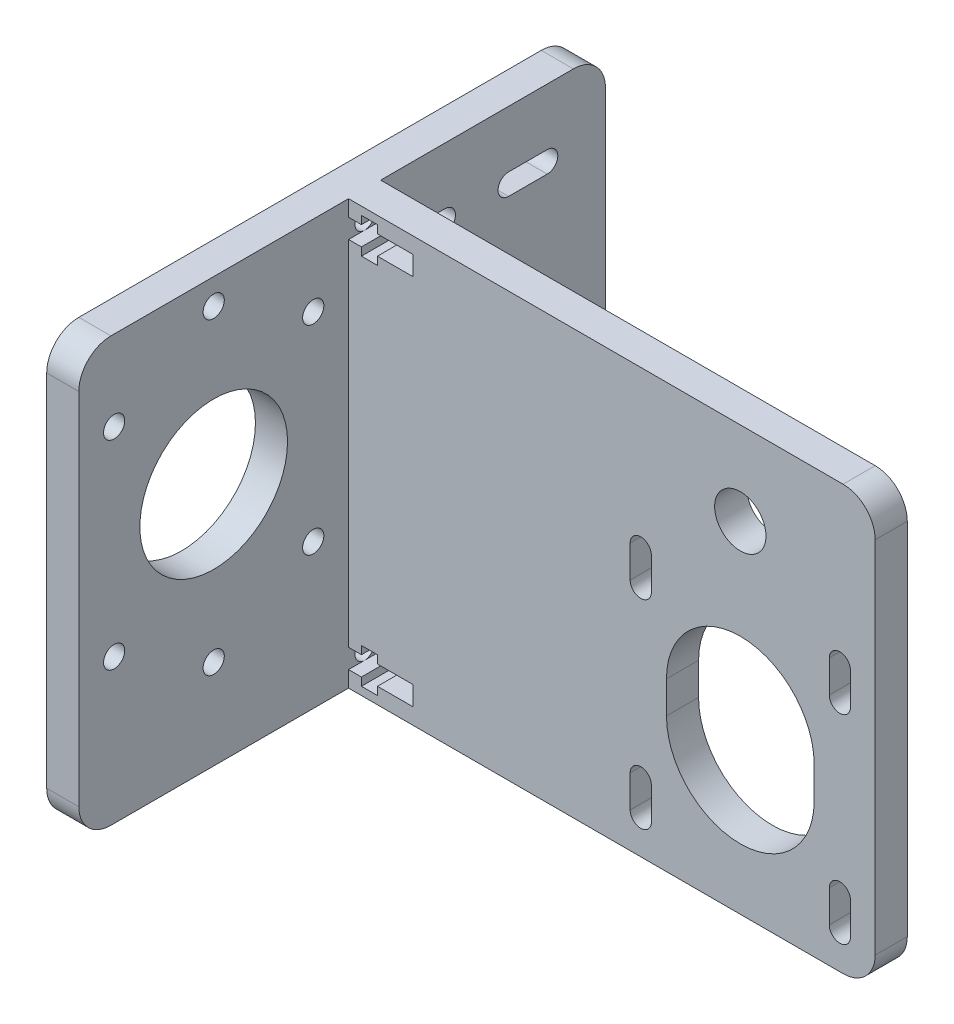
from build123d import *

# Parameters (mm, degrees)
BOSS_EXTRUDE1_DEPTH = 60
SKETCH2_R           = 1.65
SKETCH2_R_2         = 11.5
CUT_EXTRUDE1_DEPTH  = 60
SKETCH3_R           = 1.65
SKETCH3_R_2         = 11.5
CUT_EXTRUDE2_DEPTH  = 60
CUT_EXTRUDE3_START  = -21
SKETCH4_R           = 4
CUT_EXTRUDE3_DEPTH  = 21
SKETCH5_R           = 2.5
CUT_EXTRUDE4_DEPTH  = 6
CUT_EXTRUDE5_DEPTH  = 10
SKETCH9_R           = 5.25
CUT_EXTRUDE7_DEPTH  = 3
CHAMFER1_SIZE       = 1
SKETCH10_W          = 5
SKETCH10_H          = 82
BOSS_EXTRUDE2_DEPTH = 6
FILLET1_R           = 5
SKETCH11_R          = 1.65
CUT_EXTRUDE8_DEPTH  = 10
CUT_EXTRUDE9_DEPTH  = 5
SKETCH13_W          = 82
SKETCH13_H          = 5
BOSS_EXTRUDE3_DEPTH = 6
FILLET2_R           = 5
SKETCH14_R          = 1.5
CUT_EXTRUDE10_DEPTH = 5
CUT_EXTRUDE11_DEPTH = 5


with BuildPart() as part:
    # Sketch1 → Boss-Extrude1 (new body)
    with BuildSketch(Plane(origin=(0, 0, 0), x_dir=(1, 0, 0), z_dir=(0, 1, 0))):
        Polygon((0, 0), (0, -42), (-5, -42), (-5, 40), (0, 40), (0, 5), (82, 5), (82, 0), align=None)
    extrude(amount=BOSS_EXTRUDE1_DEPTH)

    # Sketch2 → Cut-Extrude1 (cut)
    with BuildSketch(Plane.XY):
        with Locations((45.5, 36.5)):
            Circle(SKETCH2_R)
        with Locations((76.5, 36.5)):
            Circle(SKETCH2_R)
        with Locations((76.5, 5.5)):
            Circle(SKETCH2_R)
        with Locations((45.5, 5.5)):
            Circle(SKETCH2_R)
        with Locations((61, 21)):
            Circle(SKETCH2_R_2)
    extrude(amount=-CUT_EXTRUDE1_DEPTH, mode=Mode.SUBTRACT)

    # Sketch3 → Cut-Extrude2 (cut)
    with BuildSketch(Plane(origin=(0, 0, 0), x_dir=(0, 0, -1), z_dir=(1, 0, 0))):
        with Locations((-36.5, 53.5)):
            Circle(SKETCH3_R)
        with Locations((-5.5, 53.5)):
            Circle(SKETCH3_R)
        with Locations((-5.5, 22.5)):
            Circle(SKETCH3_R)
        with Locations((-36.5, 22.5)):
            Circle(SKETCH3_R)
        with Locations((-21, 38)):
            Circle(SKETCH3_R_2)
    extrude(amount=-CUT_EXTRUDE2_DEPTH, mode=Mode.SUBTRACT)

    # Sketch4 → Cut-Extrude3 (cut)
    with BuildSketch(Plane(origin=(0, 0, -5), x_dir=(-1, 0, 0), z_dir=(0, 0, -1)).offset(CUT_EXTRUDE3_START)):
        with Locations((-61, 53)):
            Circle(SKETCH4_R)
        with BuildLine():
            Line((-47.15, 36.5), (-47.15, 41.5))
            ThreePointArc((-47.15, 41.5), (-45.5, 43.15), (-43.85, 41.5))
            Line((-43.85, 41.5), (-43.85, 36.5))
            ThreePointArc((-43.85, 36.5), (-45.5, 34.85), (-47.15, 36.5))
        make_face()
        with BuildLine():
            Line((-78.15, 36.5), (-78.15, 41.5))
            ThreePointArc((-78.15, 41.5), (-76.5, 43.15), (-74.85, 41.5))
            Line((-74.85, 41.5), (-74.85, 36.5))
            ThreePointArc((-74.85, 36.5), (-76.5, 34.85), (-78.15, 36.5))
        make_face()
        with BuildLine():
            Line((-78.15, 5.5), (-78.15, 10.5))
            ThreePointArc((-78.15, 10.5), (-76.5, 12.15), (-74.85, 10.5))
            Line((-74.85, 10.5), (-74.85, 5.5))
            ThreePointArc((-74.85, 5.5), (-76.5, 3.85), (-78.15, 5.5))
        make_face()
        with BuildLine():
            Line((-47.15, 5.5), (-47.15, 10.5))
            ThreePointArc((-47.15, 10.5), (-45.5, 12.15), (-43.85, 10.5))
            Line((-43.85, 10.5), (-43.85, 5.5))
            ThreePointArc((-43.85, 5.5), (-45.5, 3.85), (-47.15, 5.5))
        make_face()
        with BuildLine():
            Line((-72.5, 21), (-72.5, 26))
            ThreePointArc((-72.5, 26), (-61, 37.5), (-49.5, 26))
            Line((-49.5, 26), (-49.5, 21))
            ThreePointArc((-49.5, 21), (-61, 9.5), (-72.5, 21))
        make_face()
    extrude(amount=CUT_EXTRUDE3_DEPTH, mode=Mode.SUBTRACT)

    # Sketch5 → Cut-Extrude4 (cut)
    with BuildSketch(Plane(origin=(0, 0, 0), x_dir=(0, 0, -1), z_dir=(1, 0, 0))):
        with Locations((19, 38)):
            Circle(SKETCH5_R)
    extrude(amount=-CUT_EXTRUDE4_DEPTH, mode=Mode.SUBTRACT)

    # Sketch7 → Cut-Extrude5 (cut)
    with BuildSketch(Plane.ZY.offset(5)):
        with BuildLine():
            Line((-7, 53.85), (-15, 53.85))
            ThreePointArc((-15, 53.85), (-16.65, 55.5), (-15, 57.15))
            Line((-15, 57.15), (-7, 57.15))
            ThreePointArc((-7, 57.15), (-5.35, 55.5), (-7, 53.85))
        make_face()
        with BuildLine():
            Line((-7, 18.85), (-15, 18.85))
            ThreePointArc((-15, 18.85), (-16.65, 20.5), (-15, 22.15))
            Line((-15, 22.15), (-7, 22.15))
            ThreePointArc((-7, 22.15), (-5.35, 20.5), (-7, 18.85))
        make_face()
        with BuildLine():
            Line((-30.930481749, 57.15), (-24.930481749, 57.15))
            ThreePointArc((-24.930481749, 57.15), (-23.280481749, 55.5), (-24.930481749, 53.85))
            Line((-24.930481749, 53.85), (-30.930481749, 53.85))
            ThreePointArc((-30.930481749, 53.85), (-32.580481749, 55.5), (-30.930481749, 57.15))
        make_face()
        with BuildLine():
            Line((-30.930481749, 22.15), (-24.930481749, 22.15))
            ThreePointArc((-24.930481749, 22.15), (-23.280481749, 20.5), (-24.930481749, 18.85))
            Line((-24.930481749, 18.85), (-30.930481749, 18.85))
            ThreePointArc((-30.930481749, 18.85), (-32.580481749, 20.5), (-30.930481749, 22.15))
        make_face()
    extrude(amount=-CUT_EXTRUDE5_DEPTH, mode=Mode.SUBTRACT)

    # Sketch9 → Cut-Extrude7 (cut)
    with BuildSketch(Plane(origin=(0, 0, 0), x_dir=(0, 0, -1), z_dir=(1, 0, 0))):
        with Locations((19, 38)):
            Circle(SKETCH9_R)
    extrude(amount=-CUT_EXTRUDE7_DEPTH, mode=Mode.SUBTRACT)

    # Chamfer1
    chamfer1_edges = [part.edges().sort_by_distance(p)[0] for p in [
        (-3, 38, -16.5),
    ]]
    chamfer(chamfer1_edges, length=CHAMFER1_SIZE)

    # Sketch10 → Boss-Extrude2 (add)
    with BuildSketch(Plane(origin=(0, 60, 0), x_dir=(1, 0, 0), z_dir=(0, 1, 0))):
        with Locations((-2.5, -1)):
            Rectangle(SKETCH10_W, SKETCH10_H)
    extrude(amount=BOSS_EXTRUDE2_DEPTH)

    # Fillet1
    fillet1_edges = [part.edges().sort_by_distance(p)[0] for p in [
        (82, 0, -2.5),
        (-2.5, 66, 42),
        (-2.5, 66, -40),
        (-2.5, 0, 42),
        (-2.5, 0, -40),
    ]]
    fillet(fillet1_edges, radius=FILLET1_R)

    # Sketch11 → Cut-Extrude8 (cut)
    with BuildSketch(Plane.ZY.offset(5)):
        with Locations((21, 62)):
            Circle(SKETCH11_R)
        with Locations((21, 14)):
            Circle(SKETCH11_R)
    extrude(amount=-CUT_EXTRUDE8_DEPTH, mode=Mode.SUBTRACT)

    # Sketch12 → Cut-Extrude9 (cut)
    with BuildSketch(Plane.ZY.offset(5)):
        with BuildLine():
            Line((-15, 41.5), (-7, 41.5))
            ThreePointArc((-7, 41.5), (-3.5, 38), (-7, 34.5))
            Line((-7, 34.5), (-15, 34.5))
            ThreePointArc((-15, 34.5), (-18.5, 38), (-15, 41.5))
        make_face()
    extrude(amount=-CUT_EXTRUDE9_DEPTH, mode=Mode.SUBTRACT)

    # Sketch13 → Boss-Extrude3 (add)
    with BuildSketch(Plane(origin=(0, 60, 0), x_dir=(1, 0, 0), z_dir=(0, 1, 0))):
        with Locations((41, 2.5)):
            Rectangle(SKETCH13_W, SKETCH13_H)
    extrude(amount=BOSS_EXTRUDE3_DEPTH)

    # Fillet2
    fillet2_edges = [part.edges().sort_by_distance(p)[0] for p in [
        (82, 66, -2.5),
    ]]
    fillet(fillet2_edges, radius=FILLET2_R)

    # Sketch14 → Cut-Extrude10 (cut)
    with BuildSketch(Plane.ZY.offset(5)):
        with Locations((-2.5, 62)):
            Circle(SKETCH14_R)
        with Locations((-2.5, 4)):
            Circle(SKETCH14_R)
    extrude(amount=-CUT_EXTRUDE10_DEPTH, mode=Mode.SUBTRACT)

    # Sketch15 → Cut-Extrude11 (cut)
    with BuildSketch(Plane.XY):
        Polygon((0, 63.5), (2, 63.5), (2, 64.75), (4.5, 64.75), (4.5, 63.5), (10, 63.5), (10, 60.5), (4.5, 60.5), (4.5, 59.25), (2, 59.25), (2, 60.5), (0, 60.5), align=None)
        Polygon((4.5, 2.5), (10, 2.5), (10, 5.5), (4.5, 5.5), (4.5, 6.75), (2, 6.75), (2, 5.5), (0, 5.5), (0, 2.5), (2, 2.5), (2, 1.25), (4.5, 1.25), align=None)
    extrude(amount=-CUT_EXTRUDE11_DEPTH, mode=Mode.SUBTRACT)


solid = part.part
